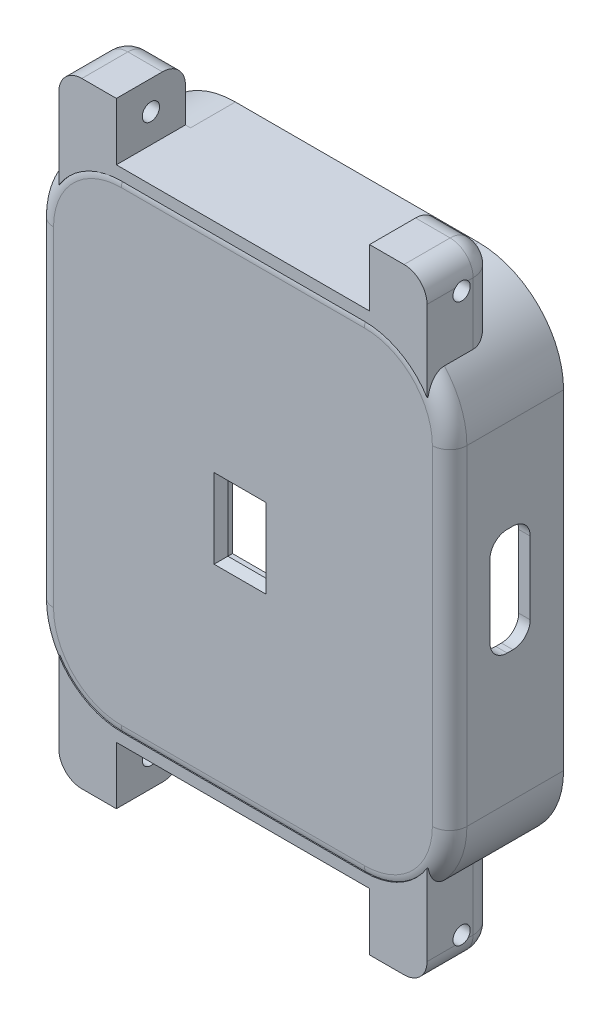
from build123d import *

# Parameters (mm, degrees)
EXTRUDE_1_DEPTH          = 1
EXTRUDE_2_DEPTH          = 9.9
SKETCH_1_4_W             = 5
SKETCH_1_4_H             = 3
SKETCH_1_4_H_2           = 2.4
EXTRUDE_3_DEPTH          = 2.5
SKETCH_1_6_W             = 3.3
SKETCH_1_6_H             = 5.7
CUT_EXTRUDE_1_DEPTH      = 4
SKETCH_1_8_W             = 0.75
SKETCH_1_8_H             = 3
SKETCH_1_8_W_2           = 0.87
SKETCH_1_8_H_2           = 2.4
EXTRUDE_5_DEPTH          = 4
CUT_EXTRUDE_2_DEPTH      = 0.5
CUT_EXTRUDE_3_DEPTH      = 10
CUT_EXTRUDE_4_DEPTH      = 10
EXTRUDE_6_DEPTH          = 9.9
FILLET_1_R               = 1.5
EXTRUDE_7_DEPTH          = 6
CUT_EXTRUDE_5_DEPTH      = 41.63476969
CUT_EXTRUDE_5_DEPTH_BACK = 41.63476969
SKETCH_6_R               = 0.75
CUT_EXTRUDE_6_DEPTH      = 41.634769756
CUT_EXTRUDE_6_DEPTH_BACK = 41.634769756
SKETCH_7_R               = 0.75
FILLET_2_R               = 2
CHAMFER_1_SIZE           = 0.6


with BuildPart() as part:
    # 草图1 → 凸台-拉伸1 (new body)
    with BuildSketch(Plane.XY):
        with BuildLine():
            Line((-10.56, 21.73), (10.56, 21.73))
            ThreePointArc((10.56, 21.73), (15.792590181, 19.562590181), (17.96, 14.33))
            Line((17.96, 14.33), (17.96, -14.33))
            ThreePointArc((17.96, -14.33), (15.792590181, -19.562590181), (10.56, -21.73))
            Line((10.56, -21.73), (-10.56, -21.73))
            ThreePointArc((-10.56, -21.73), (-15.792590181, -19.562590181), (-17.96, -14.33))
            Line((-17.96, -14.33), (-17.96, 14.33))
            ThreePointArc((-17.96, 14.33), (-15.792590181, 19.562590181), (-10.56, 21.73))
        make_face()
    extrude(amount=-EXTRUDE_1_DEPTH)

    # 草图1<3> → 凸台-拉伸2 (add)
    with BuildSketch(Plane.XY):
        with BuildLine():
            Line((-10.56, 21.73), (10.56, 21.73))
            ThreePointArc((10.56, 21.73), (15.792590181, 19.562590181), (17.96, 14.33))
            Line((17.96, 14.33), (17.96, -14.33))
            ThreePointArc((17.96, -14.33), (15.792590181, -19.562590181), (10.56, -21.73))
            Line((10.56, -21.73), (-10.56, -21.73))
            ThreePointArc((-10.56, -21.73), (-15.792590181, -19.562590181), (-17.96, -14.33))
            Line((-17.96, -14.33), (-17.96, 14.33))
            ThreePointArc((-17.96, 14.33), (-15.792590181, 19.562590181), (-10.56, 21.73))
        make_face()
        with BuildLine():
            Line((-10.56, 20.73), (10.56, 20.73))
            ThreePointArc((10.56, 20.73), (15.0854834, 18.8554834), (16.96, 14.33))
            Line((16.96, 14.33), (16.96, -14.33))
            ThreePointArc((16.96, -14.33), (15.0854834, -18.8554834), (10.56, -20.73))
            Line((10.56, -20.73), (-10.56, -20.73))
            ThreePointArc((-10.56, -20.73), (-15.0854834, -18.8554834), (-16.96, -14.33))
            Line((-16.96, -14.33), (-16.96, 14.33))
            ThreePointArc((-16.96, 14.33), (-15.0854834, 18.8554834), (-10.56, 20.73))
        make_face(mode=Mode.SUBTRACT)
    extrude(amount=-EXTRUDE_2_DEPTH)

    # 草图1<4> → 凸台-拉伸3 (add)
    with BuildSketch(Plane.XY):
        with Locations((-14.46, -12.23)):
            Rectangle(SKETCH_1_4_W, SKETCH_1_4_H)
        with Locations((14.46, -12.23)):
            Rectangle(SKETCH_1_4_W, SKETCH_1_4_H)
        with Locations((-14.46, 6.23)):
            Rectangle(SKETCH_1_4_W, SKETCH_1_4_H)
        with Locations((14.46, 7.22)):
            Rectangle(SKETCH_1_4_W, SKETCH_1_4_H_2)
    extrude(amount=-EXTRUDE_3_DEPTH)

    # 草图1<6> → 切除-拉伸1 (cut)
    with BuildSketch(Plane.XY):
        with Locations((-0.26, -0.63)):
            Rectangle(SKETCH_1_6_W, SKETCH_1_6_H)
    extrude(amount=-CUT_EXTRUDE_1_DEPTH, mode=Mode.SUBTRACT)

    # 草图1<8> → 凸台-拉伸5 (add)
    with BuildSketch(Plane.XY):
        with Locations((-16.585, 6.23)):
            Rectangle(SKETCH_1_8_W, SKETCH_1_8_H)
        with Locations((16.525, 7.22)):
            Rectangle(SKETCH_1_8_W_2, SKETCH_1_8_H_2)
        with Locations((-16.585, -12.23)):
            Rectangle(SKETCH_1_8_W, SKETCH_1_8_H)
        with Locations((16.525, -12.23)):
            Rectangle(SKETCH_1_8_W_2, SKETCH_1_8_H)
    extrude(amount=-EXTRUDE_5_DEPTH)

    # 草图2 → 切除-拉伸2 (cut)
    with BuildSketch(Plane(origin=(0, 0, -1), x_dir=(-1, 0, 0), z_dir=(0, 0, -1))):
        Polygon((-10.6, 19.47), (-15.6, 14.47), (-15.6, 8.42), (-11.96, 8.42), (6.21, 8.42), (6.21, 19.47), align=None)
    extrude(amount=-CUT_EXTRUDE_2_DEPTH, mode=Mode.SUBTRACT)

    # 草图3 → 切除-拉伸3 (cut)
    with BuildSketch(Plane.ZY.offset(17.96)):
        with BuildLine():
            Line((-3, 9.92), (-3, 12.92))
            ThreePointArc((-3, 12.92), (-3.439339828, 13.980660172), (-4.5, 14.42))
            Line((-4.5, 14.42), (-5.5, 14.42))
            ThreePointArc((-5.5, 14.42), (-6.560660172, 13.980660172), (-7, 12.92))
            Line((-7, 12.92), (-7, 9.92))
            ThreePointArc((-7, 9.92), (-6.560660172, 8.859339828), (-5.5, 8.42))
            Line((-5.5, 8.42), (-4.5, 8.42))
            ThreePointArc((-4.5, 8.42), (-3.439339828, 8.859339828), (-3, 9.92))
        make_face()
    extrude(amount=-CUT_EXTRUDE_3_DEPTH, mode=Mode.SUBTRACT)

    # 草图4 → 切除-拉伸4 (cut)
    with BuildSketch(Plane(origin=(17.96, 0, 0), x_dir=(0, 0, -1), z_dir=(1, 0, 0))):
        with BuildLine():
            ThreePointArc((5, 6.27), (3.939339828, 5.830660172), (3.5, 4.77))
            Line((3.5, 4.77), (3.5, -1.53))
            ThreePointArc((3.5, -1.53), (3.939339828, -2.590660172), (5, -3.03))
            Line((5, -3.03), (5.5, -3.03))
            ThreePointArc((5.5, -3.03), (6.560660172, -2.590660172), (7, -1.53))
            Line((7, -1.53), (7, 4.77))
            ThreePointArc((7, 4.77), (6.560660172, 5.830660172), (5.5, 6.27))
            Line((5.5, 6.27), (5, 6.27))
        make_face()
    extrude(amount=-CUT_EXTRUDE_4_DEPTH, mode=Mode.SUBTRACT)

    # 草图1<13> → 凸台-拉伸6 (add)
    with BuildSketch(Plane.XY):
        with BuildLine():
            Line((10.56, 20.73), (-10.56, 20.73))
            ThreePointArc((-10.56, 20.73), (-12.266458321, 20.498306088), (-13.84936164, 19.82))
            Line((-13.84936164, 19.82), (13.84936164, 19.82))
            ThreePointArc((13.84936164, 19.82), (12.266458321, 20.498306088), (10.56, 20.73))
        make_face()
        with BuildLine():
            Line((14.359671038, -19.48), (-14.359671038, -19.48))
            ThreePointArc((-14.359671038, -19.48), (-12.56, -20.409473661), (-10.56, -20.73))
            Line((-10.56, -20.73), (10.56, -20.73))
            ThreePointArc((10.56, -20.73), (12.56, -20.409473661), (14.359671038, -19.48))
        make_face()
    extrude(amount=-EXTRUDE_6_DEPTH)

    # 圆角1
    fillet_1_edges = [part.edges().sort_by_distance(p)[0] for p in [
        (-15.792590181, 19.562590181, 0),
        (-17.96, 0, 0),
        (-15.792590181, -19.562590181, 0),
        (0, -21.73, 0),
        (15.792590181, -19.562590181, 0),
        (17.96, 0, 0),
        (15.792590181, 19.562590181, 0),
        (0, 21.73, 0),
    ]]
    fillet(fillet_1_edges, radius=FILLET_1_R)

    # 草图5 → 凸台-拉伸7 (add)
    with BuildSketch(Plane.XY):
        with BuildLine():
            Line((16, 17.701409201), (16, 24.73))
            ThreePointArc((16, 24.73), (15.414213562, 26.144213562), (14, 26.73))
            Line((14, 26.73), (11, 26.73))
            Line((11, 26.73), (11, 21.73))
            Line((11, 21.73), (-11, 21.73))
            Line((-11, 21.73), (-11, 26.73))
            Line((-11, 26.73), (-14, 26.73))
            ThreePointArc((-14, 26.73), (-15.414213562, 26.144213562), (-16, 24.73))
            Line((-16, 24.73), (-16, 17.701409201))
            ThreePointArc((-16, 17.701409201), (-13.673115892, 19.921825234), (-10.56, 20.73))
            Line((-10.56, 20.73), (10.56, 20.73))
            ThreePointArc((10.56, 20.73), (13.673115892, 19.921825234), (16, 17.701409201))
        make_face()
        with BuildLine():
            Line((16, -24.73), (16, -17.701409201))
            ThreePointArc((16, -17.701409201), (13.673115892, -19.921825234), (10.56, -20.73))
            Line((10.56, -20.73), (-10.56, -20.73))
            ThreePointArc((-10.56, -20.73), (-13.673115892, -19.921825234), (-16, -17.701409201))
            Line((-16, -17.701409201), (-16, -24.73))
            ThreePointArc((-16, -24.73), (-15.414213562, -26.144213562), (-14, -26.73))
            Line((-14, -26.73), (-11, -26.73))
            Line((-11, -26.73), (-11, -21.73))
            Line((-11, -21.73), (11, -21.73))
            Line((11, -21.73), (11, -26.73))
            Line((11, -26.73), (14, -26.73))
            ThreePointArc((14, -26.73), (15.414213562, -26.144213562), (16, -24.73))
        make_face()
    extrude(amount=-EXTRUDE_7_DEPTH)

    # 草图6 → 切除-拉伸5 (cut, two sides: drawn at the far end of the back side and taken through both)
    with BuildSketch(Plane.ZY.offset(-11).offset(-CUT_EXTRUDE_5_DEPTH_BACK)):
        with Locations((-3, -24.23)):
            Circle(SKETCH_6_R)
    extrude(amount=CUT_EXTRUDE_5_DEPTH + CUT_EXTRUDE_5_DEPTH_BACK, mode=Mode.SUBTRACT)

    # 草图7 → 切除-拉伸6 (cut, two sides: drawn at the far end of the back side and taken through both)
    with BuildSketch(Plane.ZY.offset(-11).offset(-CUT_EXTRUDE_6_DEPTH_BACK)):
        with Locations((-3, 24.23)):
            Circle(SKETCH_7_R)
    extrude(amount=CUT_EXTRUDE_6_DEPTH + CUT_EXTRUDE_6_DEPTH_BACK, mode=Mode.SUBTRACT)

    # 圆角2
    fillet_2_edges = [part.edges().sort_by_distance(p)[0] for p in [
        (16, 22.038306201, -6),
        (15.414213562, 26.144213562, -6),
        (-16, 22.038306201, -6),
        (-15.414213562, 26.144213562, -6),
        (-16, -22.038306201, -6),
        (-15.414213562, -26.144213562, -6),
        (16, -22.038306201, -6),
        (15.414213562, -26.144213562, -6),
        (12.5, 26.73, -6),
        (-12.5, 26.73, -6),
        (-12.5, -26.73, -6),
        (12.5, -26.73, -6),
    ]]
    fillet(fillet_2_edges, radius=FILLET_2_R)

    # 倒角1
    chamfer_1_edges = [part.edges().sort_by_distance(p)[0] for p in [
        (-0.26, -3.48, 0),
        (-1.91, -0.63, 0),
        (-0.26, 2.22, 0),
        (1.39, -0.63, 0),
    ]]
    chamfer(chamfer_1_edges, length=CHAMFER_1_SIZE)


solid = part.part
